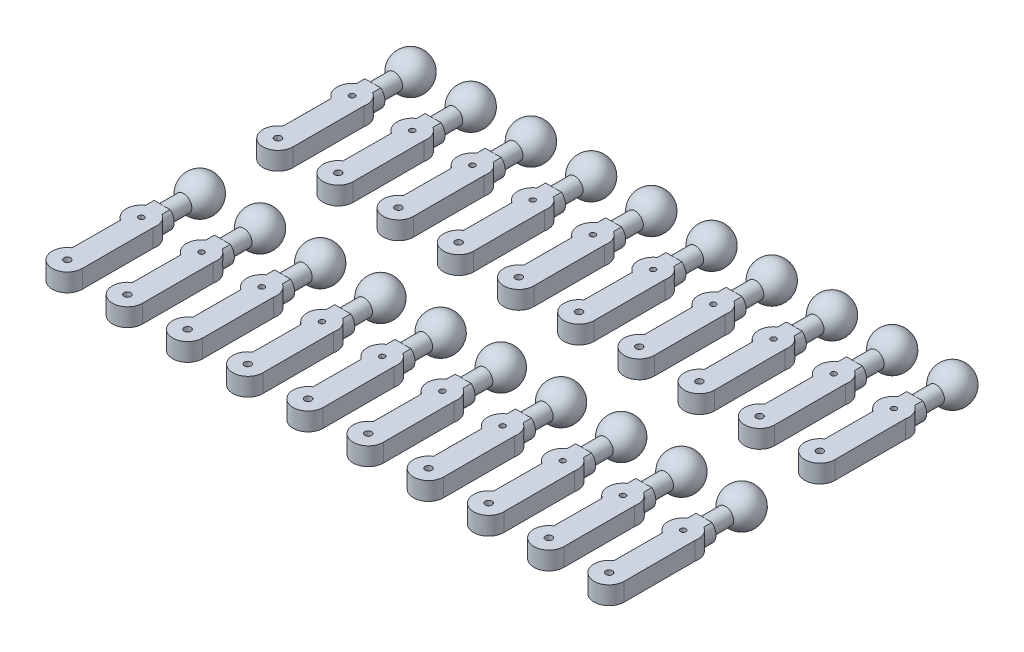
from build123d import *
from build123d.topology import SkipClean

# Parameters (mm, degrees)
SKETCH_2_R                        = 1.1
EXTRUDE_1_DEPTH                   = 17.6064
CUT_EXTRUDE_1_DEPTH               = 18.93594504
CUT_EXTRUDE_1_DEPTH_BACK          = 18.93594504
SKETCH_3_R                        = 2
SKETCH_3_3_R                      = 2
SKETCH_3_3_R_2                    = 0.45
EXTRUDE_2_DEPTH                   = 1.2
EXTRUDE_8_REACH                   = 22.084
SKETCH_7_R                        = 2
SKETCH_7_R_2                      = 0.36
EXTRUDE_9_REACH                   = 17.744
EXTRUDE_9_END_RADIUS              = 2
EXTRUDE_9_DIRECTION_2_REACH       = 17.744
EXTRUDE_9_DIRECTION_2_END_RADIUS  = 2
SKETCH_11_R                       = 0.36
CUT_EXTRUDE_2_DEPTH               = 21.084116234
EXTRUDE_10_REACH                  = 14.883
EXTRUDE_10_END_RADIUS             = 2
EXTRUDE_10_DIRECTION_2_REACH      = 14.883
EXTRUDE_10_DIRECTION_2_END_RADIUS = 2
EXTRUDE_11_REACH                  = 17.002
EXTRUDE_11_END_RADIUS             = 2
SKETCH_13_R                       = 1.6
SKETCH_14_W                       = 7.40434877
SKETCH_14_H                       = 4.06336213
CUT_EXTRUDE_3_DEPTH               = 21.084116234
SKETCH_15_W                       = 5.898333764
SKETCH_15_H                       = 3.047472445
CUT_EXTRUDE_4_DEPTH               = 21.084116234
PATTERN_LINEAR_1_COUNT            = 10
PATTERN_LINEAR_1_PITCH            = 8
PATTERN_LINEAR_1_2_COUNT          = 2
PATTERN_LINEAR_1_2_PITCH          = 28


with BuildPart() as part:
    # 草图1 → 旋转1 (revolve)
    with SkipClean():  # the faces are left unmerged after this step: merging them gives an invalid solid
        with BuildSketch(Plane.XY):
            with BuildLine():
                ThreePointArc((2.42, 0), (1.71119841, 1.71119841), (0, 2.42))
                Line((0, 2.42), (0, -2.42))
                ThreePointArc((0, -2.42), (1.71119841, -1.71119841), (2.42, 0))
            make_face()
            with BuildLine():
                Line((0, -2.42), (0, 2.42))
                ThreePointArc((0, 2.42), (-2.42, 0), (0, -2.42))
            make_face()
        revolve(axis=Axis((0, 2.42, 0), (0, -1, 0)))

    # 草图2 → 凸台-拉伸1 (add)
    with SkipClean():  # the faces are left unmerged after this step: merging them gives an invalid solid
        with BuildSketch(Plane.XY):
            with Locations(Location((0, 0, 0), (0, 0, 180))):
                Circle(SKETCH_2_R)
        extrude(amount=EXTRUDE_1_DEPTH)

    # 草图3 → 切除-拉伸1 (cut, two sides: drawn at the far end of the back side and taken through both)
    with SkipClean():  # the faces are left unmerged after this step: merging them gives an invalid solid
        with BuildSketch(Plane(origin=(0, 0, 0), x_dir=(1, 0, 0), z_dir=(0, 1, 0)).offset(-CUT_EXTRUDE_1_DEPTH_BACK)):
            with Locations((0, -17.6064)):
                Circle(SKETCH_3_R)
        extrude(amount=CUT_EXTRUDE_1_DEPTH + CUT_EXTRUDE_1_DEPTH_BACK, mode=Mode.SUBTRACT)

    # 草图3<3> → 凸台-拉伸2 (add, symmetric)
    with SkipClean():  # the faces are left unmerged after this step: merging them gives an invalid solid
        with BuildSketch(Plane(origin=(0, 0, 0), x_dir=(1, 0, 0), z_dir=(0, 1, 0))):
            with Locations(Location((0, -17.6064, 0), (0, 0, 270))):
                Circle(SKETCH_3_3_R)
            with Locations(Location((0, -17.6064, 0), (0, 0, 270))):
                Circle(SKETCH_3_3_R_2, mode=Mode.SUBTRACT)
        extrude(amount=EXTRUDE_2_DEPTH, both=True)

    # 凸台-拉伸8: up to this face of the body (flat: up to its plane)
    extrude_8_end = Plane(part.part.faces().sort_by_distance((0, -1.2, 15.662968542))[0])
    # 草图7 → 凸台-拉伸8 (add, up to the picked face)
    with BuildSketch(Plane(origin=(0, 1.2, 0), x_dir=(1, 0, 0), z_dir=(0, 1, 0)), mode=Mode.PRIVATE) as extrude_8_sk1:
        with Locations(Location((0.041050024, -7.806485975, 0), (0, 0, 270))):
            Circle(SKETCH_7_R)
        with Locations(Location((0.041050024, -7.806485975, 0), (0, 0, 270))):
            Circle(SKETCH_7_R_2, mode=Mode.SUBTRACT)
    extrude_8_tool1 = split(extrude(extrude_8_sk1.sketch, amount=-EXTRUDE_8_REACH, mode=Mode.PRIVATE), bisect_by=extrude_8_end, keep=Keep.BOTH, mode=Mode.PRIVATE)
    add(extrude_8_tool1.solids().sort_by(Axis((0.04105, 1.2, 5.863055), (0, -1, 0)))[0])

    # 凸台-拉伸9: up to this cylinder (the profile starts outside it)
    with SkipClean():  # the faces are left unmerged after this step: merging them gives an invalid solid
        extrude_9_end = Plane(origin=(0.041050024, 0, 7.806485975), z_dir=(0, 1, 0)) * Cylinder(EXTRUDE_9_END_RADIUS, 40.488, mode=Mode.PRIVATE)
        # 草图10 → 凸台-拉伸9 (add, up to the surface)
        with BuildSketch(Plane(origin=(0.020525012, 1.2, 12.706442988), x_dir=(-0.9999912270311377, 0, -0.0041887779554037885), z_dir=(0.0041887779554037885, 0, -0.9999912270311377)), mode=Mode.PRIVATE) as extrude_9_sk1:
            with BuildLine():
                Line((1.058300524, 0), (0, 0))
                Line((0, 0), (0, -2.4))
                Line((0, -2.4), (1.058300524, -2.4))
                ThreePointArc((1.058300524, -2.4), (1.458300524, -1.858300524), (1.6, -1.2))
                ThreePointArc((1.6, -1.2), (1.458300524, -0.541699476), (1.058300524, 0))
            make_face()
        extrude_9_tool1 = extrude(extrude_9_sk1.sketch, amount=EXTRUDE_9_REACH, mode=Mode.PRIVATE) - extrude_9_end
        add(extrude_9_tool1.solids().sort_by_distance((-0.704839, 0, 12.703405))[0])
        # 草图10 → 凸台-拉伸9 (add, up to the surface)
        with BuildSketch(Plane(origin=(0.020525012, 1.2, 12.706442988), x_dir=(-0.9999912270311377, 0, -0.0041887779554037885), z_dir=(0.0041887779554037885, 0, -0.9999912270311377)), mode=Mode.PRIVATE) as extrude_9_sk2:
            with BuildLine():
                Line((0, -2.4), (0, 0))
                Line((0, 0), (-1.058300524, 0))
                ThreePointArc((-1.058300524, 0), (-1.6, -1.2), (-1.058300524, -2.4))
                Line((-1.058300524, -2.4), (0, -2.4))
            make_face()
        extrude_9_tool2 = extrude(extrude_9_sk2.sketch, amount=EXTRUDE_9_REACH, mode=Mode.PRIVATE) - extrude_9_end
        add(extrude_9_tool2.solids().sort_by_distance((0.745889, 0, 12.709481))[0])
        # 草图10 → 凸台-拉伸9 (add, up to the surface)
        with BuildSketch(Plane(origin=(0.020525012, 1.2, 12.706442988), x_dir=(-0.9999912270311377, 0, -0.0041887779554037885), z_dir=(0.0041887779554037885, 0, -0.9999912270311377)), mode=Mode.PRIVATE) as extrude_9_sk3:
            with BuildLine():
                Line((1.058300524, 0), (0, 0))
                Line((0, 0), (0, -2.4))
                Line((0, -2.4), (1.058300524, -2.4))
                ThreePointArc((1.058300524, -2.4), (1.458300524, -1.858300524), (1.6, -1.2))
                ThreePointArc((1.6, -1.2), (1.458300524, -0.541699476), (1.058300524, 0))
            make_face()
        extrude_9_tool3 = extrude(extrude_9_sk3.sketch, amount=EXTRUDE_9_REACH, mode=Mode.PRIVATE) - extrude_9_end
        add(extrude_9_tool3.solids().sort_by_distance((-0.704839, 0, 12.703405))[0])
        # 草图10 → 凸台-拉伸9 (add, up to the surface)
        with BuildSketch(Plane(origin=(0.020525012, 1.2, 12.706442988), x_dir=(-0.9999912270311377, 0, -0.0041887779554037885), z_dir=(0.0041887779554037885, 0, -0.9999912270311377)), mode=Mode.PRIVATE) as extrude_9_sk4:
            with BuildLine():
                Line((0, -2.4), (0, 0))
                Line((0, 0), (-1.058300524, 0))
                ThreePointArc((-1.058300524, 0), (-1.6, -1.2), (-1.058300524, -2.4))
                Line((-1.058300524, -2.4), (0, -2.4))
            make_face()
        extrude_9_tool4 = extrude(extrude_9_sk4.sketch, amount=EXTRUDE_9_REACH, mode=Mode.PRIVATE) - extrude_9_end
        add(extrude_9_tool4.solids().sort_by_distance((0.745889, 0, 12.709481))[0])

    # 凸台-拉伸9 direction 2: up to this cylinder (the profile starts outside it)
    with SkipClean():  # the faces are left unmerged after this step: merging them gives an invalid solid
        extrude_9_direction_2_end = Plane(origin=(0, 0, 17.6064), z_dir=(0, -1, 0)) * Cylinder(EXTRUDE_9_DIRECTION_2_END_RADIUS, 40.488, mode=Mode.PRIVATE)
        # 草图10 → 凸台-拉伸9 direction 2 (add, up to the surface)
        with BuildSketch(Plane(origin=(0.020525012, 1.2, 12.706442988), x_dir=(-0.9999912270311377, 0, -0.0041887779554037885), z_dir=(0.0041887779554037885, 0, -0.9999912270311377)), mode=Mode.PRIVATE) as extrude_9_direction_2_sk1:
            with BuildLine():
                Line((1.058300524, 0), (0, 0))
                Line((0, 0), (0, -2.4))
                Line((0, -2.4), (1.058300524, -2.4))
                ThreePointArc((1.058300524, -2.4), (1.458300524, -1.858300524), (1.6, -1.2))
                ThreePointArc((1.6, -1.2), (1.458300524, -0.541699476), (1.058300524, 0))
            make_face()
        extrude_9_direction_2_tool1 = extrude(extrude_9_direction_2_sk1.sketch, amount=-EXTRUDE_9_DIRECTION_2_REACH, mode=Mode.PRIVATE) - extrude_9_direction_2_end
        add(extrude_9_direction_2_tool1.solids().sort_by_distance((-0.704839, 0, 12.703405))[0])
        # 草图10 → 凸台-拉伸9 direction 2 (add, up to the surface)
        with BuildSketch(Plane(origin=(0.020525012, 1.2, 12.706442988), x_dir=(-0.9999912270311377, 0, -0.0041887779554037885), z_dir=(0.0041887779554037885, 0, -0.9999912270311377)), mode=Mode.PRIVATE) as extrude_9_direction_2_sk2:
            with BuildLine():
                Line((0, -2.4), (0, 0))
                Line((0, 0), (-1.058300524, 0))
                ThreePointArc((-1.058300524, 0), (-1.6, -1.2), (-1.058300524, -2.4))
                Line((-1.058300524, -2.4), (0, -2.4))
            make_face()
        extrude_9_direction_2_tool2 = extrude(extrude_9_direction_2_sk2.sketch, amount=-EXTRUDE_9_DIRECTION_2_REACH, mode=Mode.PRIVATE) - extrude_9_direction_2_end
        add(extrude_9_direction_2_tool2.solids().sort_by_distance((0.745889, 0, 12.709481))[0])
        # 草图10 → 凸台-拉伸9 direction 2 (add, up to the surface)
        with BuildSketch(Plane(origin=(0.020525012, 1.2, 12.706442988), x_dir=(-0.9999912270311377, 0, -0.0041887779554037885), z_dir=(0.0041887779554037885, 0, -0.9999912270311377)), mode=Mode.PRIVATE) as extrude_9_direction_2_sk3:
            with BuildLine():
                Line((1.058300524, 0), (0, 0))
                Line((0, 0), (0, -2.4))
                Line((0, -2.4), (1.058300524, -2.4))
                ThreePointArc((1.058300524, -2.4), (1.458300524, -1.858300524), (1.6, -1.2))
                ThreePointArc((1.6, -1.2), (1.458300524, -0.541699476), (1.058300524, 0))
            make_face()
        extrude_9_direction_2_tool3 = extrude(extrude_9_direction_2_sk3.sketch, amount=-EXTRUDE_9_DIRECTION_2_REACH, mode=Mode.PRIVATE) - extrude_9_direction_2_end
        add(extrude_9_direction_2_tool3.solids().sort_by_distance((-0.704839, 0, 12.703405))[0])
        # 草图10 → 凸台-拉伸9 direction 2 (add, up to the surface)
        with BuildSketch(Plane(origin=(0.020525012, 1.2, 12.706442988), x_dir=(-0.9999912270311377, 0, -0.0041887779554037885), z_dir=(0.0041887779554037885, 0, -0.9999912270311377)), mode=Mode.PRIVATE) as extrude_9_direction_2_sk4:
            with BuildLine():
                Line((0, -2.4), (0, 0))
                Line((0, 0), (-1.058300524, 0))
                ThreePointArc((-1.058300524, 0), (-1.6, -1.2), (-1.058300524, -2.4))
                Line((-1.058300524, -2.4), (0, -2.4))
            make_face()
        extrude_9_direction_2_tool4 = extrude(extrude_9_direction_2_sk4.sketch, amount=-EXTRUDE_9_DIRECTION_2_REACH, mode=Mode.PRIVATE) - extrude_9_direction_2_end
        add(extrude_9_direction_2_tool4.solids().sort_by_distance((0.745889, 0, 12.709481))[0])

    # 草图11 → 切除-拉伸2 (cut, through all)
    with SkipClean():  # the faces are left unmerged after this step: merging them gives an invalid solid
        with BuildSketch(Plane(origin=(0, 1.2, 0), x_dir=(1, 0, 0), z_dir=(0, 1, 0))):
            with Locations(Location((0.041050024, -7.806485975, 0), (0, 0, 270))):
                Circle(SKETCH_11_R)
        extrude(amount=-CUT_EXTRUDE_2_DEPTH, mode=Mode.SUBTRACT)

    # 凸台-拉伸10: up to this cylinder (the profile starts outside it)
    with SkipClean():  # the faces are left unmerged after this step: merging them gives an invalid solid
        extrude_10_end = Plane(origin=(0.041050024, 0, 7.806485975), z_dir=(0, 1, 0)) * Cylinder(EXTRUDE_10_END_RADIUS, 34.766, mode=Mode.PRIVATE)
        # 草图12 → 凸台-拉伸10 (add, up to the surface)
        with BuildSketch(Plane.XY.offset(10), mode=Mode.PRIVATE) as extrude_10_sk1:
            Polygon((0, 0), (0, 1.2), (2, 1.2), (2, -1.2), (0, -1.2), align=None)
        extrude_10_tool1 = extrude(extrude_10_sk1.sketch, amount=-EXTRUDE_10_REACH, mode=Mode.PRIVATE) - extrude_10_end
        add(extrude_10_tool1.solids().sort_by_distance((1, 0, 10))[0])

    # 凸台-拉伸10 direction 2: up to this cylinder (the profile starts outside it)
    with SkipClean():  # the faces are left unmerged after this step: merging them gives an invalid solid
        extrude_10_direction_2_end = Plane(origin=(0, 0, 17.6064), z_dir=(0, -1, 0)) * Cylinder(EXTRUDE_10_DIRECTION_2_END_RADIUS, 34.766, mode=Mode.PRIVATE)
        # 草图12 → 凸台-拉伸10 direction 2 (add, up to the surface)
        with BuildSketch(Plane.XY.offset(10), mode=Mode.PRIVATE) as extrude_10_direction_2_sk1:
            Polygon((0, 0), (0, 1.2), (2, 1.2), (2, -1.2), (0, -1.2), align=None)
        extrude_10_direction_2_tool1 = extrude(extrude_10_direction_2_sk1.sketch, amount=EXTRUDE_10_DIRECTION_2_REACH, mode=Mode.PRIVATE) - extrude_10_direction_2_end
        add(extrude_10_direction_2_tool1.solids().sort_by_distance((1, 0, 10))[0])

    # 凸台-拉伸11: up to this cylinder (the profile starts outside it)
    with SkipClean():  # the faces are left unmerged after this step: merging them gives an invalid solid
        extrude_11_end = Plane(origin=(0.041050024, 0, 7.806485975), z_dir=(0, 1, 0)) * Cylinder(EXTRUDE_11_END_RADIUS, 39.004, mode=Mode.PRIVATE)
        # 草图13 → 凸台-拉伸11 (add, up to the surface)
        with BuildSketch(Plane.XY.offset(5), mode=Mode.PRIVATE) as extrude_11_sk1:
            with Locations(Location((0, 0, 0), (0, 0, 131.409594385))):
                Circle(SKETCH_13_R)
        extrude_11_tool1 = extrude(extrude_11_sk1.sketch, amount=EXTRUDE_11_REACH, mode=Mode.PRIVATE) - extrude_11_end
        add(extrude_11_tool1.solids().sort_by_distance((0, 0, 5))[0])

    # 草图14 → 切除-拉伸3 (cut, through all)
    with SkipClean():  # the faces are left unmerged after this step: merging them gives an invalid solid
        with BuildSketch(Plane(origin=(0, 1.2, 0), x_dir=(1, 0, 0), z_dir=(0, 1, 0))):
            with Locations((0.094582813, -5.966785927)):
                Rectangle(SKETCH_14_W, SKETCH_14_H)
        extrude(amount=CUT_EXTRUDE_3_DEPTH, mode=Mode.SUBTRACT)

    # 草图15 → 切除-拉伸4 (cut, through all)
    with SkipClean():  # the faces are left unmerged after this step: merging them gives an invalid solid
        with BuildSketch(Plane.XZ.offset(1.2)):
            with Locations((0.081921302, 5.906181286)):
                Rectangle(SKETCH_15_W, SKETCH_15_H)
        extrude(amount=CUT_EXTRUDE_4_DEPTH, mode=Mode.SUBTRACT)


with BuildPart() as pattern_linear_1_1:
    # 阵列(线性)1: pattern copy
    add(part.part.moved(Location(Vector(1, 0, 0) * (1 * PATTERN_LINEAR_1_PITCH))))


with BuildPart() as pattern_linear_1_2:
    # 阵列(线性)1: pattern copy
    add(part.part.moved(Location(Vector(1, 0, 0) * (2 * PATTERN_LINEAR_1_PITCH))))


with BuildPart() as pattern_linear_1_3:
    # 阵列(线性)1: pattern copy
    add(part.part.moved(Location(Vector(1, 0, 0) * (3 * PATTERN_LINEAR_1_PITCH))))


with BuildPart() as pattern_linear_1_4:
    # 阵列(线性)1: pattern copy
    add(part.part.moved(Location(Vector(1, 0, 0) * (4 * PATTERN_LINEAR_1_PITCH))))


with BuildPart() as pattern_linear_1_5:
    # 阵列(线性)1: pattern copy
    add(part.part.moved(Location(Vector(1, 0, 0) * (5 * PATTERN_LINEAR_1_PITCH))))


with BuildPart() as pattern_linear_1_6:
    # 阵列(线性)1: pattern copy
    add(part.part.moved(Location(Vector(1, 0, 0) * (6 * PATTERN_LINEAR_1_PITCH))))


with BuildPart() as pattern_linear_1_7:
    # 阵列(线性)1: pattern copy
    add(part.part.moved(Location(Vector(1, 0, 0) * (7 * PATTERN_LINEAR_1_PITCH))))


with BuildPart() as pattern_linear_1_8:
    # 阵列(线性)1: pattern copy
    add(part.part.moved(Location(Vector(1, 0, 0) * (8 * PATTERN_LINEAR_1_PITCH))))


with BuildPart() as pattern_linear_1_9:
    # 阵列(线性)1: pattern copy
    add(part.part.moved(Location(Vector(1, 0, 0) * (9 * PATTERN_LINEAR_1_PITCH))))


with BuildPart() as pattern_linear_1_2_1:
    # Pattern Linear 1 2: pattern copy
    add(part.part.moved(Location(Vector(0, 0, 1) * (1 * PATTERN_LINEAR_1_2_PITCH))))


with BuildPart() as pattern_linear_1_2_2:
    # Pattern Linear 1 2: pattern copy
    add(pattern_linear_1_1.part.moved(Location(Vector(0, 0, 1) * (1 * PATTERN_LINEAR_1_2_PITCH))))


with BuildPart() as pattern_linear_1_2_3:
    # Pattern Linear 1 2: pattern copy
    add(pattern_linear_1_2.part.moved(Location(Vector(0, 0, 1) * (1 * PATTERN_LINEAR_1_2_PITCH))))


with BuildPart() as pattern_linear_1_2_4:
    # Pattern Linear 1 2: pattern copy
    add(pattern_linear_1_3.part.moved(Location(Vector(0, 0, 1) * (1 * PATTERN_LINEAR_1_2_PITCH))))


with BuildPart() as pattern_linear_1_2_5:
    # Pattern Linear 1 2: pattern copy
    add(pattern_linear_1_4.part.moved(Location(Vector(0, 0, 1) * (1 * PATTERN_LINEAR_1_2_PITCH))))


with BuildPart() as pattern_linear_1_2_6:
    # Pattern Linear 1 2: pattern copy
    add(pattern_linear_1_5.part.moved(Location(Vector(0, 0, 1) * (1 * PATTERN_LINEAR_1_2_PITCH))))


with BuildPart() as pattern_linear_1_2_7:
    # Pattern Linear 1 2: pattern copy
    add(pattern_linear_1_6.part.moved(Location(Vector(0, 0, 1) * (1 * PATTERN_LINEAR_1_2_PITCH))))


with BuildPart() as pattern_linear_1_2_8:
    # Pattern Linear 1 2: pattern copy
    add(pattern_linear_1_7.part.moved(Location(Vector(0, 0, 1) * (1 * PATTERN_LINEAR_1_2_PITCH))))


with BuildPart() as pattern_linear_1_2_9:
    # Pattern Linear 1 2: pattern copy
    add(pattern_linear_1_8.part.moved(Location(Vector(0, 0, 1) * (1 * PATTERN_LINEAR_1_2_PITCH))))


with BuildPart() as pattern_linear_1_2_10:
    # Pattern Linear 1 2: pattern copy
    add(pattern_linear_1_9.part.moved(Location(Vector(0, 0, 1) * (1 * PATTERN_LINEAR_1_2_PITCH))))


solid = Compound([part.part, pattern_linear_1_1.part, pattern_linear_1_2.part, pattern_linear_1_3.part, pattern_linear_1_4.part, pattern_linear_1_5.part, pattern_linear_1_6.part, pattern_linear_1_7.part, pattern_linear_1_8.part, pattern_linear_1_9.part, pattern_linear_1_2_1.part, pattern_linear_1_2_2.part, pattern_linear_1_2_3.part, pattern_linear_1_2_4.part, pattern_linear_1_2_5.part, pattern_linear_1_2_6.part, pattern_linear_1_2_7.part, pattern_linear_1_2_8.part, pattern_linear_1_2_9.part, pattern_linear_1_2_10.part])
